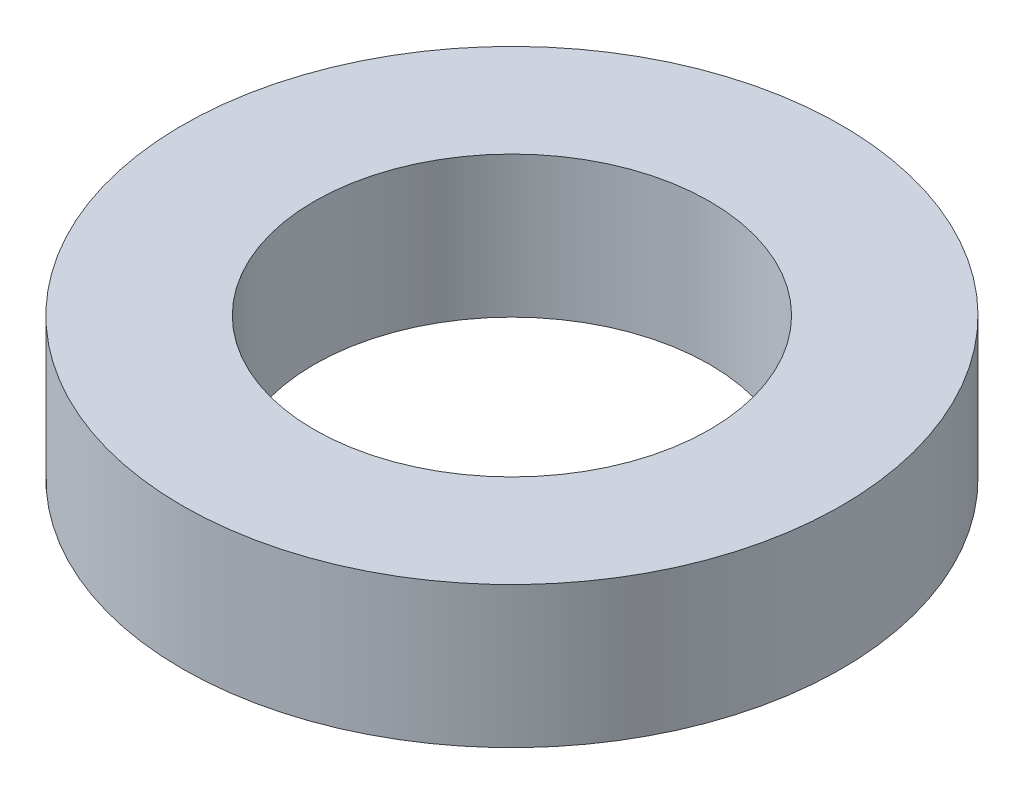
from build123d import *

# Parameters (mm, degrees)
SKETCH_1_R      = 3.5
SKETCH_1_R_2    = 2.1
EXTRUDE_1_DEPTH = 1.5


with BuildPart() as part:
    # 草图1 → 凸台-拉伸1 (new body)
    with BuildSketch(Plane(origin=(0, 0, 0), x_dir=(1, 0, 0), z_dir=(0, 1, 0))):
        with Locations(Location((0, 0, 0), (0, 0, 270))):
            Circle(SKETCH_1_R)
        with Locations(Location((0, 0, 0), (0, 0, 270))):
            Circle(SKETCH_1_R_2, mode=Mode.SUBTRACT)
    extrude(amount=EXTRUDE_1_DEPTH)


solid = part.part
